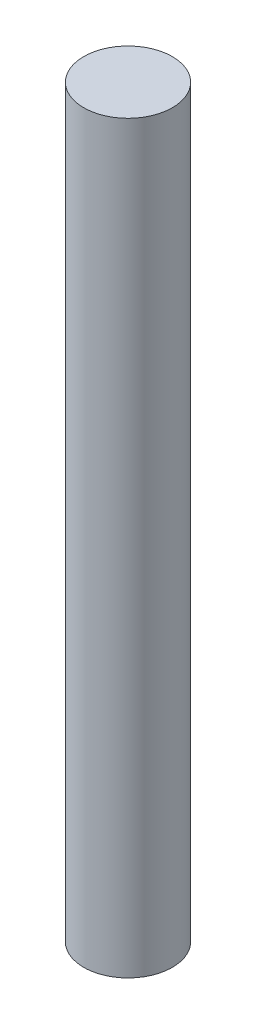
from build123d import *

# Parameters (mm, degrees)
SKETCH_1_R      = 2.5
EXTRUDE_1_DEPTH = 42


with BuildPart() as part:
    # 草图1 → 凸台-拉伸1 (new body)
    with BuildSketch(Plane(origin=(0, 0, 0), x_dir=(1, 0, 0), z_dir=(0, 1, 0))):
        with Locations(Location((0, 0, 0), (0, 0, 90))):
            Circle(SKETCH_1_R)
    extrude(amount=EXTRUDE_1_DEPTH)


solid = part.part
